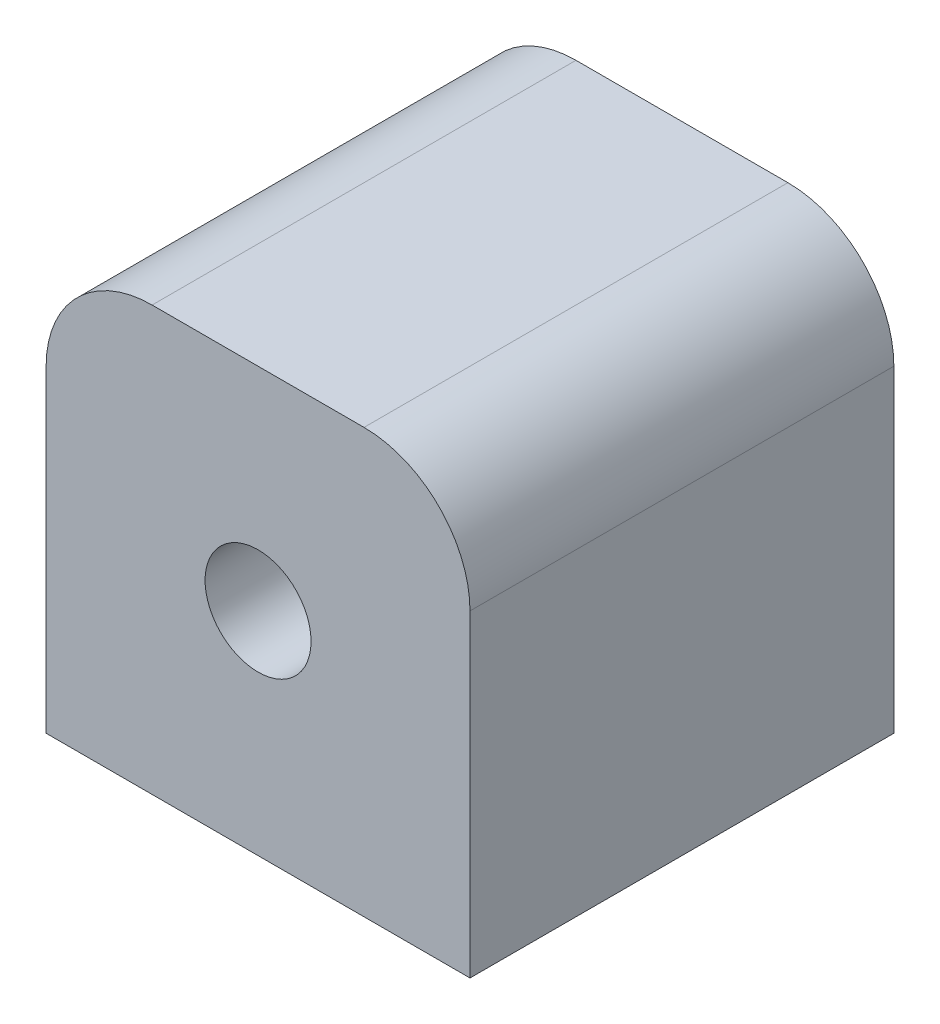
from build123d import *

# Parameters (mm, degrees)
SKETCH1_W                        = 40
SKETCH1_H                        = 40
BOSS_EXTRUDE1_DEPTH              = 40
SKETCH2_R                        = 5
CUT_EXTRUDE1_DEPTH               = 61
FILLET1_R                        = 10
M6_5_CLEARANCE_HOLE1_D           = 7.1
M6_5_CLEARANCE_HOLE1_DEPTH       = 10
M6_5_CLEARANCE_HOLE1_CSINK_D     = 7.15
M6_5_CLEARANCE_HOLE1_CSINK_ANGLE = 100
M6_5_CLEARANCE_HOLE1_TIP         = 2.133055198
SKETCH6_R                        = 5
CUT_EXTRUDE2_DEPTH               = 10


with BuildPart() as part:
    # Sketch1 → Boss-Extrude1 (new body)
    with BuildSketch(Plane(origin=(0, 0, 0), x_dir=(1, 0, 0), z_dir=(0, 1, 0))):
        Rectangle(SKETCH1_W, SKETCH1_H)
    extrude(amount=BOSS_EXTRUDE1_DEPTH)

    # Sketch2 → Cut-Extrude1 (cut, through all)
    with BuildSketch(Plane.XY.offset(20)):
        with Locations((0, 20)):
            Circle(SKETCH2_R)
    extrude(amount=-CUT_EXTRUDE1_DEPTH, mode=Mode.SUBTRACT)

    # Fillet1
    fillet1_edges = [part.edges().sort_by_distance(p)[0] for p in [
        (-20, 40, 0),
        (20, 40, 0),
    ]]
    fillet(fillet1_edges, radius=FILLET1_R)

    # M6.5 Clearance Hole1
    with Locations(Plane(origin=(0, 0, 0), x_dir=(-1, 0, 0), z_dir=(0, -1, 0))):
        with Locations((-10, 10), (10, 10), (-10, -10), (10, -10)):
            CounterSinkHole(M6_5_CLEARANCE_HOLE1_D / 2, M6_5_CLEARANCE_HOLE1_CSINK_D / 2, depth=M6_5_CLEARANCE_HOLE1_DEPTH, counter_sink_angle=M6_5_CLEARANCE_HOLE1_CSINK_ANGLE)
            with Locations((0, 0, -(M6_5_CLEARANCE_HOLE1_DEPTH + M6_5_CLEARANCE_HOLE1_TIP / 2))):  # 118° drill point
                Cone(0, M6_5_CLEARANCE_HOLE1_D / 2, M6_5_CLEARANCE_HOLE1_TIP, mode=Mode.SUBTRACT)

    # Sketch6 → Cut-Extrude2 (cut)
    with BuildSketch(Plane.XZ):
        with Locations(Location((0, 0, 0), (0, 0, 270))):
            Circle(SKETCH6_R)
    extrude(amount=-CUT_EXTRUDE2_DEPTH, mode=Mode.SUBTRACT)


solid = part.part
